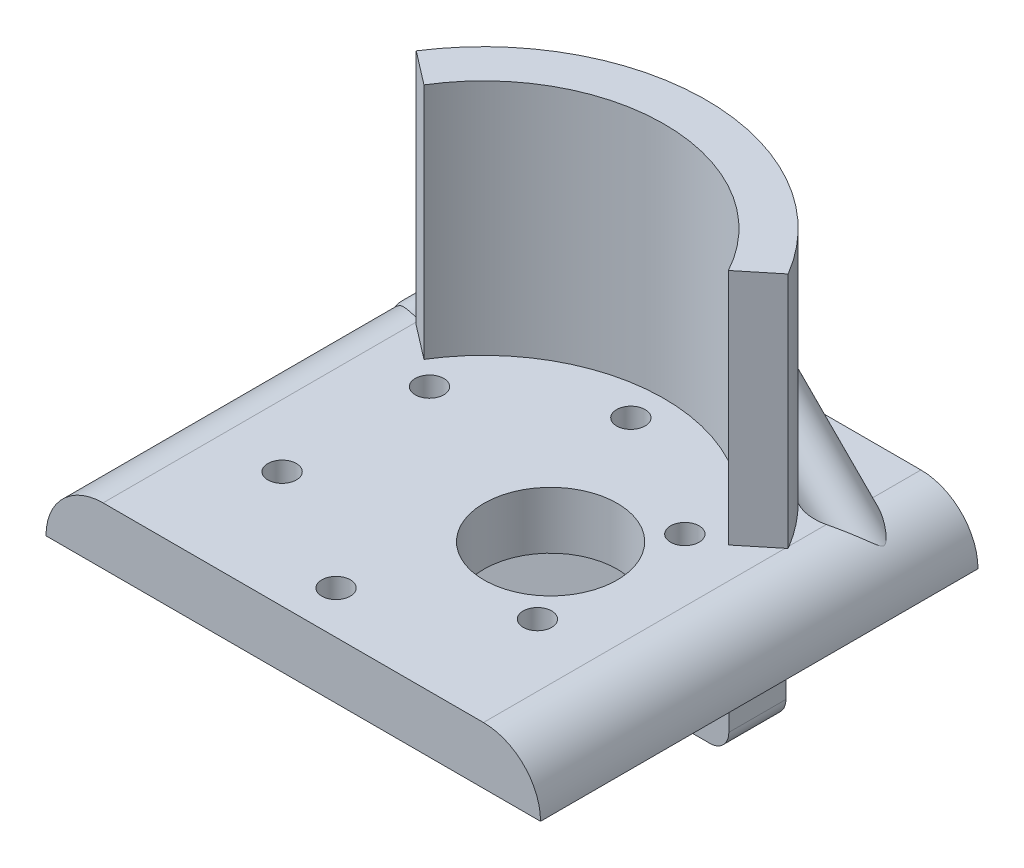
from build123d import *

# Parameters (mm, degrees)
BOSS_EXTRUDE1_DEPTH      = 6
BOSS_EXTRUDE2_DEPTH      = 40
CUT_EXTRUDE1_REACH       = 62.762
SKETCH9_R                = 1.5
CUT_EXTRUDE2_REACH       = 62.762
SKETCH10_R               = 7
BOSS_EXTRUDE4_DEPTH      = 25
BOSS_EXTRUDE5_REACH      = 73.576
BOSS_EXTRUDE5_END_RADIUS = 23.4
SKETCH12_R               = 2.5
BOSS_EXTRUDE6_REACH      = 73.576
SKETCH14_R               = 2.5
SKETCH15_W               = 42.894850158
SKETCH15_H               = 27.148059605
CUT_EXTRUDE3_DEPTH       = 6
FILLET1_R                = 2
SKETCH7_R                = 4
CUT_EXTRUDE4_DEPTH       = 3


with BuildPart() as part:
    # Sketch3 → Boss-Extrude1 (new body)
    with BuildSketch(Plane.XY):
        with BuildLine():
            Line((-20, 10.240601504), (20, 10.240601504))
            ThreePointArc((20, 10.240601504), (24.242640687, 8.483242191), (26, 4.240601504))
            Line((26, 4.240601504), (26, -13.759398496))
            ThreePointArc((26, -13.759398496), (24.242640687, -18.002039183), (20, -19.759398496))
            Line((20, -19.759398496), (-20, -19.759398496))
            ThreePointArc((-20, -19.759398496), (-24.242640687, -18.002039183), (-26, -13.759398496))
            Line((-26, -13.759398496), (-26, 4.240601504))
            ThreePointArc((-26, 4.240601504), (-24.242640687, 8.483242191), (-20, 10.240601504))
        make_face()
    extrude(amount=BOSS_EXTRUDE1_DEPTH)

    # Sketch4 → Boss-Extrude2 (add)
    with BuildSketch(Plane.XY.offset(6)):
        with BuildLine():
            Line((-26, 4.240601504), (26, 4.240601504))
            ThreePointArc((26, 4.240601504), (24.242640687, 8.483242191), (20, 10.240601504))
            Line((20, 10.240601504), (-20, 10.240601504))
            ThreePointArc((-20, 10.240601504), (-24.242640687, 8.483242191), (-26, 4.240601504))
        make_face()
    extrude(amount=BOSS_EXTRUDE2_DEPTH)

    # Sketch9 → Cut-Extrude1 (cut, up to next)
    with BuildSketch(Plane(origin=(0, 10.240601504, 0), x_dir=(1, 0, 0), z_dir=(0, 1, 0)), mode=Mode.PRIVATE) as cut_extrude1_sk1:
        with Locations(Location((0, -41.5, 0), (0, 0, 180))):
            Circle(SKETCH9_R)
    cut_extrude1_tool1 = extrude(cut_extrude1_sk1.sketch, amount=-CUT_EXTRUDE1_REACH, mode=Mode.PRIVATE) & part.part
    # Sketch9 → Cut-Extrude1 (cut, up to next)
    with BuildSketch(Plane(origin=(0, 10.240601504, 0), x_dir=(1, 0, 0), z_dir=(0, 1, 0)), mode=Mode.PRIVATE) as cut_extrude1_sk2:
        with Locations(Location((13.423393759, -33.75, 0), (0, 0, 180))):
            Circle(SKETCH9_R)
    cut_extrude1_tool2 = extrude(cut_extrude1_sk2.sketch, amount=-CUT_EXTRUDE1_REACH, mode=Mode.PRIVATE) & part.part
    # Sketch9 → Cut-Extrude1 (cut, up to next)
    with BuildSketch(Plane(origin=(0, 10.240601504, 0), x_dir=(1, 0, 0), z_dir=(0, 1, 0)), mode=Mode.PRIVATE) as cut_extrude1_sk3:
        with Locations(Location((-13.423393759, -33.75, 0), (0, 0, 180))):
            Circle(SKETCH9_R)
    cut_extrude1_tool3 = extrude(cut_extrude1_sk3.sketch, amount=-CUT_EXTRUDE1_REACH, mode=Mode.PRIVATE) & part.part
    # Sketch9 → Cut-Extrude1 (cut, up to next)
    with BuildSketch(Plane(origin=(0, 10.240601504, 0), x_dir=(1, 0, 0), z_dir=(0, 1, 0)), mode=Mode.PRIVATE) as cut_extrude1_sk4:
        with Locations(Location((-13.423393759, -18.25, 0), (0, 0, 180))):
            Circle(SKETCH9_R)
    cut_extrude1_tool4 = extrude(cut_extrude1_sk4.sketch, amount=-CUT_EXTRUDE1_REACH, mode=Mode.PRIVATE) & part.part
    # Sketch9 → Cut-Extrude1 (cut, up to next)
    with BuildSketch(Plane(origin=(0, 10.240601504, 0), x_dir=(1, 0, 0), z_dir=(0, 1, 0)), mode=Mode.PRIVATE) as cut_extrude1_sk5:
        with Locations(Location((0, -10.5, 0), (0, 0, 180))):
            Circle(SKETCH9_R)
    cut_extrude1_tool5 = extrude(cut_extrude1_sk5.sketch, amount=-CUT_EXTRUDE1_REACH, mode=Mode.PRIVATE) & part.part
    # Sketch9 → Cut-Extrude1 (cut, up to next)
    with BuildSketch(Plane(origin=(0, 10.240601504, 0), x_dir=(1, 0, 0), z_dir=(0, 1, 0)), mode=Mode.PRIVATE) as cut_extrude1_sk6:
        with Locations(Location((13.423393759, -18.25, 0), (0, 0, 180))):
            Circle(SKETCH9_R)
    cut_extrude1_tool6 = extrude(cut_extrude1_sk6.sketch, amount=-CUT_EXTRUDE1_REACH, mode=Mode.PRIVATE) & part.part
    add(cut_extrude1_tool1.solids().sort_by_distance((0, 10.240602, 41.5))[0], mode=Mode.SUBTRACT)
    add(cut_extrude1_tool2.solids().sort_by_distance((13.423394, 10.240602, 33.75))[0], mode=Mode.SUBTRACT)
    add(cut_extrude1_tool3.solids().sort_by_distance((-13.423394, 10.240602, 33.75))[0], mode=Mode.SUBTRACT)
    add(cut_extrude1_tool4.solids().sort_by_distance((-13.423394, 10.240602, 18.25))[0], mode=Mode.SUBTRACT)
    add(cut_extrude1_tool5.solids().sort_by_distance((0, 10.240602, 10.5))[0], mode=Mode.SUBTRACT)
    add(cut_extrude1_tool6.solids().sort_by_distance((13.423394, 10.240602, 18.25))[0], mode=Mode.SUBTRACT)

    # Sketch10 → Cut-Extrude2 (cut, up to next)
    with BuildSketch(Plane(origin=(0, 10.240601504, 0), x_dir=(1, 0, 0), z_dir=(0, 1, 0)), mode=Mode.PRIVATE) as cut_extrude2_sk1:
        with Locations(Location((7.059090501, -26, 0), (0, 0, 180))):
            Circle(SKETCH10_R)
    cut_extrude2_tool1 = extrude(cut_extrude2_sk1.sketch, amount=-CUT_EXTRUDE2_REACH, mode=Mode.PRIVATE) & part.part
    add(cut_extrude2_tool1.solids().sort_by_distance((7.059091, 10.240602, 26))[0], mode=Mode.SUBTRACT)

    # Sketch11 → Boss-Extrude4 (add)
    with BuildSketch(Plane(origin=(0, 10.240601504, 0), x_dir=(1, 0, 0), z_dir=(0, 1, 0))):
        with BuildLine():
            Line((16.710143733, -16.95726278), (20.169460133, -14.136068192))
            ThreePointArc((20.169460133, -14.136068192), (0.449710611, -2.604321759), (-19.698633669, -13.369725595))
            Line((-19.698633669, -13.369725595), (-16.193668166, -16.061936238))
            ThreePointArc((-16.193668166, -16.061936238), (0.516806692, -7.007029963), (16.710143733, -16.95726278))
        make_face()
    extrude(amount=BOSS_EXTRUDE4_DEPTH)

    # Boss-Extrude5: up to this cylinder (the profile starts outside it)
    boss_extrude5_end = Plane(origin=(0, 6.683051, 26), z_dir=(0, -1, 0)) * Cylinder(BOSS_EXTRUDE5_END_RADIUS, 194.952, mode=Mode.PRIVATE)
    # Sketch12 → Boss-Extrude5 (add, up to the surface)
    with BuildSketch(Plane(origin=(7.879699248, -7.879699248, 0), x_dir=(0, 0, 1), z_dir=(-0.7071067811865489, 0.7071067811865462, 0)), mode=Mode.PRIVATE) as boss_extrude5_sk1:
        with Locations((7.574761701, 20.594839086)):
            Circle(SKETCH12_R)
    boss_extrude5_tool1 = extrude(boss_extrude5_sk1.sketch, amount=BOSS_EXTRUDE5_REACH, mode=Mode.PRIVATE) - boss_extrude5_end
    add(boss_extrude5_tool1.solids().sort_by_distance((22.44245, 6.683051, 7.574762))[0])

    # Sketch14 → Boss-Extrude6 (add, up to next)
    with BuildSketch(Plane(origin=(-7.879699248, -7.879699248, 0), x_dir=(0, 0, -1), z_dir=(0.7071067811865487, 0.7071067811865465, 0)), mode=Mode.PRIVATE) as boss_extrude6_sk1:
        with Locations((-10.283332747, 20.780524406)):
            Circle(SKETCH14_R)
    boss_extrude6_tool1 = extrude(boss_extrude6_sk1.sketch, amount=BOSS_EXTRUDE6_REACH, mode=Mode.PRIVATE) - part.part
    add(boss_extrude6_tool1.solids().sort_by_distance((-22.573749, 6.81435, 10.283333))[0])

    # Sketch15 → Cut-Extrude3 (cut)
    with BuildSketch(Plane(origin=(0, 0, 0), x_dir=(-1, 0, 0), z_dir=(0, 0, -1))):
        with Locations((-27.245771634, -9.333428299)):
            Rectangle(SKETCH15_W, SKETCH15_H)
    extrude(amount=-CUT_EXTRUDE3_DEPTH, mode=Mode.SUBTRACT)

    # Fillet1
    fillet1_edges = [part.edges().sort_by_distance(p)[0] for p in [
        (5.798346555, -19.759398496, 3),
        (5.798346555, 4.240601504, 3),
    ]]
    fillet(fillet1_edges, radius=FILLET1_R)

    # Sketch7 → Cut-Extrude4 (cut)
    with BuildSketch(Plane(origin=(0, 0, 0), x_dir=(-1, 0, 0), z_dir=(0, 0, -1))):
        with Locations((0, -4.759398496)):
            Circle(SKETCH7_R)
    extrude(amount=-CUT_EXTRUDE4_DEPTH, mode=Mode.SUBTRACT)


solid = part.part
